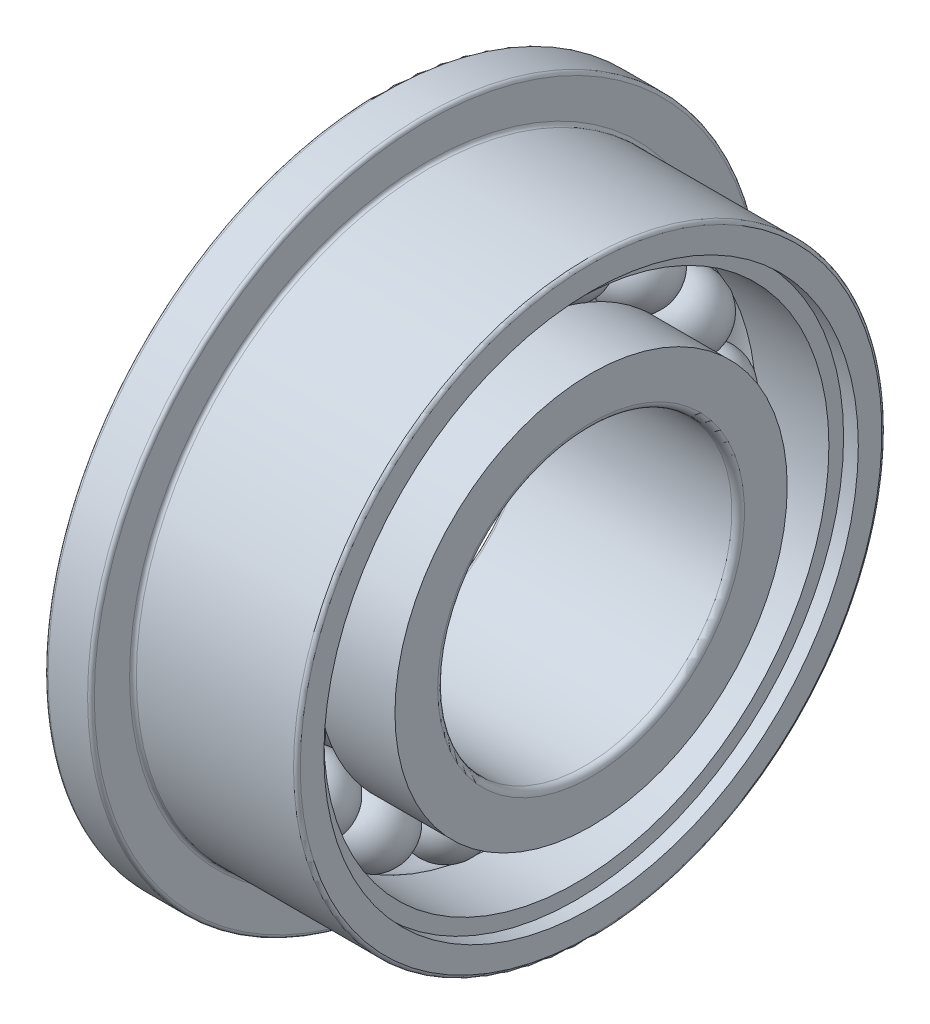
from build123d import *

# Parameters (mm, degrees)
CIRCULAR_PATTERN1_COUNT = 17
FILLET1_R               = 0.15
FILLET2_R               = 0.08
EXTRUDE_START           = -1.1
SKETCH_1_R              = 8
SKETCH_1_R_2            = 7
EXTRUDE_1_DEPTH         = 1.1
FILLET_1_R              = 0.08


with BuildPart() as part:
    # Sketch1 → Revolve1 (revolve)
    with BuildSketch(Plane.XY):
        with BuildLine():
            Line((-0.875, 5.25), (0.875, 5.25))
            ThreePointArc((0.875, 5.25), (0, 4.375), (-0.875, 5.25))
        make_face()
    revolve1 = revolve(axis=Axis((-3.091912561, 5.25, 0), (1, 0, 0)))

    # Sketch2 → Revolve2 (revolve)
    with BuildSketch(Plane.XY, mode=Mode.PRIVATE) as revolve2_sk:
        with BuildLine():
            Line((-2.5, 4.666666667), (-0.638707462, 4.666666667))
            ThreePointArc((-0.638707462, 4.666666667), (0, 4.385), (0.638707462, 4.666666667))
            Line((0.638707462, 4.666666667), (2.5, 4.666666667))
            Line((2.5, 4.666666667), (2.5, 3.5))
            Line((2.5, 3.5), (-2.5, 3.5))
            Line((-2.5, 3.5), (-2.5, 4.666666667))
        make_face()
    revolve(revolve2_sk.sketch.rotate(Axis((-2.992358943, 0, 0), (1, 0, 0)), 90), axis=Axis((-2.992358943, 0, 0), (1, 0, 0)))

    # Sketch3 → Revolve3 (revolve)
    with BuildSketch(Plane.XY, mode=Mode.PRIVATE) as revolve3_sk:
        with BuildLine():
            Line((-2.5, 5.833333333), (-2.5, 7))
            Line((-2.5, 7), (2.5, 7))
            Line((2.5, 7), (2.5, 6.358333333))
            Line((2.5, 6.358333333), (2.15, 6.358333333))
            Line((2.15, 6.358333333), (2.15, 6.008333333))
            Line((2.15, 6.008333333), (0.416119641, 6.008333333))
            ThreePointArc((0.416119641, 6.008333333), (-0.141571835, 6.103336051), (-0.638707462, 5.833333333))
            Line((-0.638707462, 5.833333333), (-2.5, 5.833333333))
        make_face()
    revolve(revolve3_sk.sketch.rotate(Axis((-2.992358943, 0, 0), (1, 0, 0)), 90), axis=Axis((-2.992358943, 0, 0), (1, 0, 0)))

    # Circular-Pattern1: Revolve1 ×17 about axis
    circular_pattern1_axis = Axis((0, 0, 0), (1, 0, 0))
    for i in range(1, CIRCULAR_PATTERN1_COUNT):
        add(revolve1.rotate(circular_pattern1_axis, i * 360 / CIRCULAR_PATTERN1_COUNT))

    # Fillet1
    fillet1_edges = [part.edges().sort_by_distance(p)[0] for p in [
        (2.5, 0, -3.5),
    ]]
    fillet(fillet1_edges, radius=FILLET1_R)

    # Fillet2
    fillet2_edges = [part.edges().sort_by_distance(p)[0] for p in [
        (2.5, 0, -7),
        (-2.5, 0, -3.5),
    ]]
    fillet(fillet2_edges, radius=FILLET2_R)

    # 草图1 → 凸台-拉伸1 (add)
    with BuildSketch(Plane.ZY.offset(2.5).offset(EXTRUDE_START)):
        Circle(SKETCH_1_R)
        Circle(SKETCH_1_R_2, mode=Mode.SUBTRACT)
    extrude(amount=EXTRUDE_1_DEPTH)

    # 圆角1
    fillet_1_edges = [part.edges().sort_by_distance(p)[0] for p in [
        (-1.4, 0, -7),
        (-1.4, 0, -8),
        (-2.5, 0, -8),
    ]]
    fillet(fillet_1_edges, radius=FILLET_1_R)


solid = part.part
